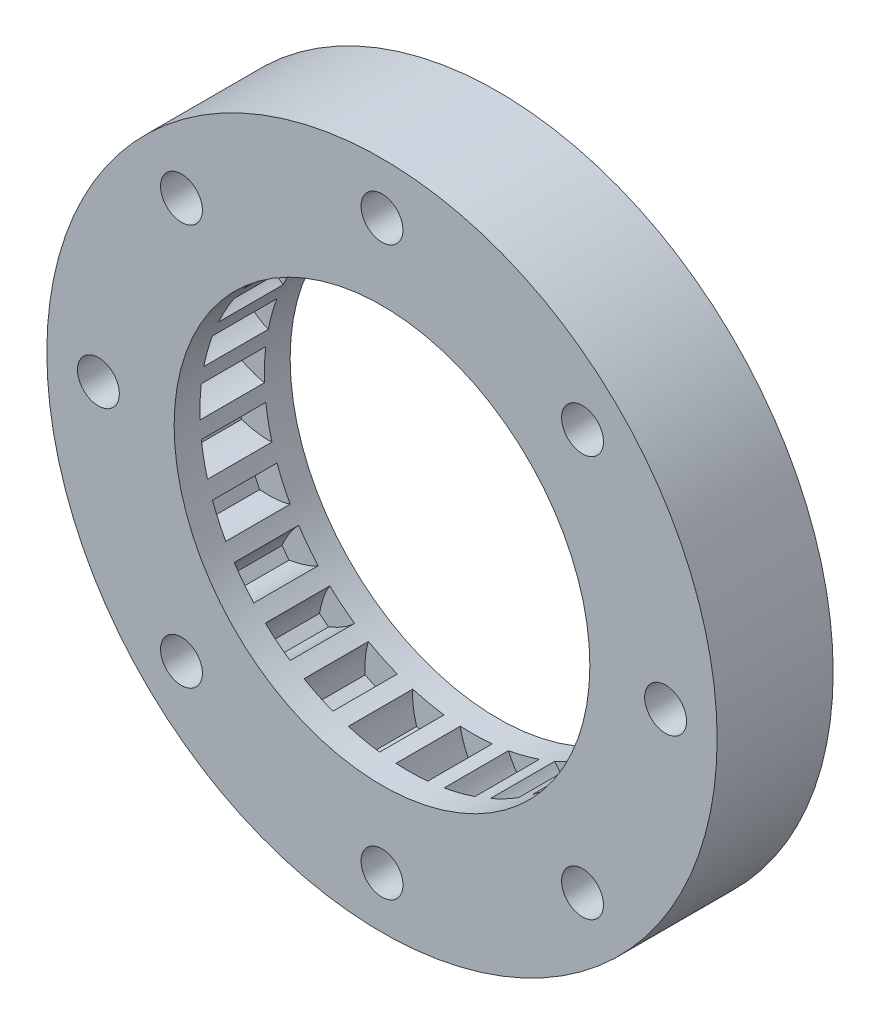
from build123d import *

# Parameters (mm, degrees)
CROQUIS77_R                 = 26
CROQUIS77_R_2               = 16.125
CROQUIS77_R_3               = 1.625
SALIENTE_EXTRUIR1_DEPTH     = 9
CORTAR_EXTRUIR34_DEPTH      = 2.5
CORTAR_EXTRUIR34_DEPTH_BACK = 2.5


with BuildPart() as part:
    # Croquis77 → Saliente-Extruir1 (new body)
    with BuildSketch(Plane(origin=(0, -88.245525224, 0), x_dir=(1, 0, 0), z_dir=(0, 0, 1))):
        with Locations((226.61482719, 201.987096474)):
            Circle(CROQUIS77_R)
        with Locations((226.61482719, 201.987096474)):
            Circle(CROQUIS77_R_2, mode=Mode.SUBTRACT)
        with Locations((248.61482719, 201.987096474)):
            Circle(CROQUIS77_R_3, mode=Mode.SUBTRACT)
        with Locations((242.171176376, 186.430747288)):
            Circle(CROQUIS77_R_3, mode=Mode.SUBTRACT)
        with Locations((226.61482719, 179.987096474)):
            Circle(CROQUIS77_R_3, mode=Mode.SUBTRACT)
        with Locations((211.058478003, 186.430747288)):
            Circle(CROQUIS77_R_3, mode=Mode.SUBTRACT)
        with Locations((204.61482719, 201.987096474)):
            Circle(CROQUIS77_R_3, mode=Mode.SUBTRACT)
        with Locations((211.058478003, 217.54344566)):
            Circle(CROQUIS77_R_3, mode=Mode.SUBTRACT)
        with Locations((226.61482719, 223.987096474)):
            Circle(CROQUIS77_R_3, mode=Mode.SUBTRACT)
        with Locations((242.171176376, 217.54344566)):
            Circle(CROQUIS77_R_3, mode=Mode.SUBTRACT)
    extrude(amount=SALIENTE_EXTRUIR1_DEPTH)

    # Croquis80 → Cortar-Extruir34 (cut, two sides: drawn at the far end of the back side and taken through both)
    with BuildSketch(Plane(origin=(0, -88.245525224, 4.5), x_dir=(1, 0, 0), z_dir=(0, 0, 1)).offset(-CORTAR_EXTRUIR34_DEPTH_BACK)):
        with BuildLine():
            Line((209.076345498, 207.32663772), (208.83645806, 206.463797463))
            add(Edge.make_bspline(
                [(210.901865378, 205.054739598), (210.81477289, 205.090460196), (210.684168137, 205.142933934), (210.508569892, 205.226843539), (210.364583833, 205.301843923), (210.202459466, 205.393823438), (210.021733392, 205.505267626), (209.822054637, 205.639174671), (209.602681203, 205.798511697), (209.263519123, 206.066501995), (209.009024187, 206.295687384), (208.83645806, 206.463797463)],
                knots=[0, 0, 0, 0, 0.112240047, 0.167638162, 0.231904779, 0.305712064, 0.389762058, 0.484920987, 0.592209309, 0.712851342, 1, 1, 1, 1], degree=3))
            Line((210.901865378, 205.054739598), (211.57264766, 207.467445999))
            add(Edge.make_bspline(
                [(211.57264766, 207.467445999), (211.47961584, 207.481803684), (211.340668669, 207.504270956), (211.146959049, 207.523036576), (210.984923748, 207.53311646), (210.798589266, 207.538015712), (210.586275802, 207.535844644), (210.346135245, 207.524216465), (210.076000604, 207.500972808), (209.647185976, 207.446495919), (209.310917813, 207.381554891), (209.076345498, 207.32663772)],
                knots=[0, 0, 0, 0, 0.112240047, 0.167638162, 0.231904779, 0.305712064, 0.389762058, 0.484920987, 0.592209309, 0.712851342, 1, 1, 1, 1], degree=3))
        make_face()
        with BuildLine():
            Line((210.780746184, 211.227251372), (210.348340286, 210.442990936))
            add(Edge.make_bspline(
                [(212.033123177, 208.595598701), (211.956616015, 208.650441356), (211.841633006, 208.731620186), (211.690118921, 208.853763739), (211.567310305, 208.959947948), (211.430767956, 209.086836596), (211.280614176, 209.236955092), (211.117198877, 209.413301745), (210.94048433, 209.618934817), (210.672267223, 209.95791756), (210.477486019, 210.239615798), (210.348340286, 210.442990936)],
                knots=[0, 0, 0, 0, 0.112240047, 0.167638162, 0.231904779, 0.305712064, 0.389762058, 0.484920987, 0.592209309, 0.712851342, 1, 1, 1, 1], degree=3))
            Line((212.033123177, 208.595598701), (213.242232823, 210.788577249))
            add(Edge.make_bspline(
                [(213.242232823, 210.788577249), (213.155019798, 210.824002535), (213.024999275, 210.877907622), (212.840838773, 210.940839925), (212.685495736, 210.988016015), (212.505313769, 211.035754896), (212.298222559, 211.082605205), (212.061873379, 211.126670689), (211.793659897, 211.166350903), (211.363840787, 211.212233904), (211.021660344, 211.226592145), (210.780746184, 211.227251372)],
                knots=[0, 0, 0, 0, 0.112240047, 0.167638162, 0.231904779, 0.305712064, 0.389762058, 0.484920987, 0.592209309, 0.712851342, 1, 1, 1, 1], degree=3))
        make_face()
        with BuildLine():
            Line((213.338747944, 214.62966163), (212.7371347, 213.966260698))
            add(Edge.make_bspline(
                [(213.95046608, 211.780127486), (213.888668765, 211.851135616), (213.795506265, 211.956643167), (213.676244504, 212.110435877), (213.581233973, 212.242079493), (213.477634678, 212.397036674), (213.366148019, 212.577736552), (213.247805938, 212.787015919), (213.123277004, 213.027859304), (212.940464525, 213.419559845), (212.815897758, 213.738584508), (212.7371347, 213.966260698)],
                knots=[0, 0, 0, 0, 0.112240047, 0.167638162, 0.231904779, 0.305712064, 0.389762058, 0.484920987, 0.592209309, 0.712851342, 1, 1, 1, 1], degree=3))
            Line((213.95046608, 211.780127486), (215.632719676, 213.63515414))
            add(Edge.make_bspline(
                [(215.632719676, 213.63515414), (215.556027123, 213.68973724), (215.441942689, 213.772174105), (215.277259445, 213.875880394), (215.136983255, 213.957609417), (214.97266746, 214.045614311), (214.781962844, 214.138960283), (214.562146687, 214.236343848), (214.310313821, 214.336808763), (213.90266189, 214.48057809), (213.573016203, 214.573461543), (213.338747944, 214.62966163)],
                knots=[0, 0, 0, 0, 0.112240047, 0.167638162, 0.231904779, 0.305712064, 0.389762058, 0.484920987, 0.592209309, 0.712851342, 1, 1, 1, 1], degree=3))
        make_face()
        with BuildLine():
            Line((216.612448239, 217.350443675), (215.874060774, 216.843666364))
            add(Edge.make_bspline(
                [(216.550529636, 214.436647183), (216.506773678, 214.519992721), (216.440454101, 214.644141053), (216.359874095, 214.821291916), (216.297783693, 214.971297998), (216.232712515, 215.145969929), (216.165903254, 215.347509611), (216.099014242, 215.578439388), (216.033384308, 215.841509157), (215.945831924, 216.264810819), (215.898195021, 216.603963204), (215.874060774, 216.843666364)],
                knots=[0, 0, 0, 0, 0.112240047, 0.167638162, 0.231904779, 0.305712064, 0.389762058, 0.484920987, 0.592209309, 0.712851342, 1, 1, 1, 1], degree=3))
            Line((216.550529636, 214.436647183), (218.615236456, 215.853716975))
            add(Edge.make_bspline(
                [(218.615236456, 215.853716975), (218.55319889, 215.924515301), (218.461200866, 216.03103975), (218.324872995, 216.169929193), (218.207225978, 216.281805115), (218.067634662, 216.405331656), (217.903597577, 216.540140986), (217.712164788, 216.685592659), (217.490288914, 216.841426184), (217.126780781, 217.075331196), (216.827441135, 217.241732491), (216.612448239, 217.350443675)],
                knots=[0, 0, 0, 0, 0.112240047, 0.167638162, 0.231904779, 0.305712064, 0.389762058, 0.484920987, 0.592209309, 0.712851342, 1, 1, 1, 1], degree=3))
        make_face()
        with BuildLine():
            Line((220.42536104, 219.242919445), (219.590006013, 218.920086249))
            add(Edge.make_bspline(
                [(219.693143746, 216.421944127), (219.669788038, 216.513133893), (219.63388669, 216.649230138), (219.596332529, 216.840188905), (219.570509565, 217.000470585), (219.547474508, 217.185440658), (219.528944349, 217.396955088), (219.517114411, 217.637085791), (219.513921604, 217.908199784), (219.526349287, 218.340282264), (219.558210366, 218.681278579), (219.590006013, 218.920086249)],
                knots=[0, 0, 0, 0, 0.112240047, 0.167638162, 0.231904779, 0.305712064, 0.389762058, 0.484920987, 0.592209309, 0.712851342, 1, 1, 1, 1], degree=3))
            Line((219.693143746, 216.421944127), (222.02899491, 217.324662458))
            add(Edge.make_bspline(
                [(222.02899491, 217.324662458), (221.984956792, 217.407859253), (221.920004815, 217.532728526), (221.81938179, 217.699313557), (221.730706326, 217.835305118), (221.623364893, 217.987693958), (221.49483862, 218.156699041), (221.342109391, 218.342377484), (221.162151893, 218.545178595), (220.862384378, 218.856609411), (220.60948825, 219.087557811), (220.42536104, 219.242919445)],
                knots=[0, 0, 0, 0, 0.112240047, 0.167638162, 0.231904779, 0.305712064, 0.389762058, 0.484920987, 0.592209309, 0.712851342, 1, 1, 1, 1], degree=3))
        make_face()
        with BuildLine():
            Line((224.57193123, 220.205065079), (223.684642848, 220.083580021))
            add(Edge.make_bspline(
                [(223.208889268, 217.628990445), (223.207192925, 217.723108376), (223.203645256, 217.86381555), (223.211141495, 218.058287584), (223.222978091, 218.220204036), (223.243220982, 218.405500467), (223.27396889, 218.615586847), (223.31783578, 218.851972966), (223.377252225, 219.116515359), (223.488989996, 219.534084979), (223.598631417, 219.858542023), (223.684642848, 220.083580021)],
                knots=[0, 0, 0, 0, 0.112240047, 0.167638162, 0.231904779, 0.305712064, 0.389762058, 0.484920987, 0.592209309, 0.712851342, 1, 1, 1, 1], degree=3))
            Line((223.208889268, 217.628990445), (225.689958436, 217.968691537))
            add(Edge.make_bspline(
                [(225.689958436, 217.968691537), (225.666293872, 218.05980164), (225.631889521, 218.196284003), (225.572395954, 218.381583979), (225.517472562, 218.534359839), (225.448167816, 218.707395656), (225.362081239, 218.901485383), (225.256289242, 219.117380624), (225.127951677, 219.35621626), (224.908085322, 219.728383565), (224.715266409, 220.011428581), (224.57193123, 220.205065079)],
                knots=[0, 0, 0, 0, 0.112240047, 0.167638162, 0.231904779, 0.305712064, 0.389762058, 0.484920987, 0.592209309, 0.712851342, 1, 1, 1, 1], degree=3))
        make_face()
        with BuildLine():
            Line((228.828616137, 220.185011059), (227.937228346, 220.271423429))
            add(Edge.make_bspline(
                [(226.908231453, 217.992713958), (226.928285923, 218.084686132), (226.95728319, 218.222418675), (227.009425704, 218.409919938), (227.058283747, 218.564742205), (227.120713286, 218.740375614), (227.199081633, 218.937708133), (227.296280476, 219.157606033), (227.415103018, 219.401315276), (227.620127065, 219.781860749), (227.80163803, 220.07228696), (227.937228346, 220.271423429)],
                knots=[0, 0, 0, 0, 0.112240047, 0.167638162, 0.231904779, 0.305712064, 0.389762058, 0.484920987, 0.592209309, 0.712851342, 1, 1, 1, 1], degree=3))
            Line((226.908231453, 217.992713958), (229.400763543, 217.751084437))
            add(Edge.make_bspline(
                [(229.400763543, 217.751084437), (229.398748297, 217.845196079), (229.396746318, 217.985933732), (229.381589524, 218.179959084), (229.363379136, 218.341283057), (229.335847314, 218.525637446), (229.296841384, 218.73434839), (229.243689893, 218.96882146), (229.173890971, 219.23081593), (229.04577883, 219.643656088), (228.923432048, 219.963538691), (228.828616137, 220.185011059)],
                knots=[0, 0, 0, 0, 0.112240047, 0.167638162, 0.231904779, 0.305712064, 0.389762058, 0.484920987, 0.592209309, 0.712851342, 1, 1, 1, 1], degree=3))
        make_face()
        with BuildLine():
            Line((232.965936776, 219.183838501), (232.118504522, 219.473489786))
            add(Edge.make_bspline(
                [(230.591737805, 217.493506238), (230.632461948, 217.578374411), (230.692440899, 217.705707125), (230.786418672, 217.876129377), (230.869664212, 218.015510949), (230.970914806, 218.172012895), (231.092678735, 218.345953305), (231.237969517, 218.537508233), (231.409792401, 218.747245898), (231.697049823, 219.07025192), (231.940645031, 219.310990345), (232.118504522, 219.473489786)],
                knots=[0, 0, 0, 0, 0.112240047, 0.167638162, 0.231904779, 0.305712064, 0.389762058, 0.484920987, 0.592209309, 0.712851342, 1, 1, 1, 1], degree=3))
            Line((230.591737805, 217.493506238), (232.961359768, 216.683572413))
            add(Edge.make_bspline(
                [(232.961359768, 216.683572413), (232.981102481, 216.775612012), (233.011610802, 216.913017751), (233.041607887, 217.105308522), (233.061092231, 217.266483591), (233.076817581, 217.452217958), (233.086995117, 217.664298459), (233.089349542, 217.904708854), (233.081852142, 218.175737968), (233.052400773, 218.606994659), (233.007121869, 218.946469895), (232.965936776, 219.183838501)],
                knots=[0, 0, 0, 0, 0.112240047, 0.167638162, 0.231904779, 0.305712064, 0.389762058, 0.484920987, 0.592209309, 0.712851342, 1, 1, 1, 1], degree=3))
        make_face()
        with BuildLine():
            Line((236.760849121, 217.255520876), (236.003057697, 217.732795901))
            add(Edge.make_bspline(
                [(234.060829544, 216.158279702), (234.120027909, 216.231468609), (234.207755065, 216.341536955), (234.338501731, 216.485692687), (234.451646979, 216.602119468), (234.586260183, 216.731052889), (234.744855369, 216.872224019), (234.930405426, 217.025109199), (235.145965636, 217.189568274), (235.499970312, 217.437621506), (235.792517481, 217.615693875), (236.003057697, 217.732795901)],
                knots=[0, 0, 0, 0, 0.112240047, 0.167638162, 0.231904779, 0.305712064, 0.389762058, 0.484920987, 0.592209309, 0.712851342, 1, 1, 1, 1], degree=3))
            Line((234.060829544, 216.158279702), (236.179794446, 214.823705316))
            add(Edge.make_bspline(
                [(236.179794446, 214.823705316), (236.220230784, 214.908710993), (236.281604693, 215.035377239), (236.355138506, 215.215566983), (236.411267176, 215.367904159), (236.46940194, 215.545005517), (236.528214268, 215.749022259), (236.585947683, 215.982409393), (236.641155991, 216.247861901), (236.711953124, 216.674285966), (236.746183097, 217.015052636), (236.760849121, 217.255520876)],
                knots=[0, 0, 0, 0, 0.112240047, 0.167638162, 0.231904779, 0.305712064, 0.389762058, 0.484920987, 0.592209309, 0.712851342, 1, 1, 1, 1], degree=3))
        make_face()
        with BuildLine():
            Line((240.008768464, 214.504014289), (239.381470601, 215.143183032))
            add(Edge.make_bspline(
                [(237.128487036, 214.059016758), (237.202968225, 214.116580766), (237.313714192, 214.203450931), (237.474181164, 214.31356867), (237.611126431, 214.400764062), (237.771845211, 214.495178126), (237.958721747, 214.595969402), (238.174528026, 214.701942755), (238.422204656, 214.812257208), (238.823872102, 214.971985037), (239.149599939, 215.077791422), (239.381470601, 215.143183032)],
                knots=[0, 0, 0, 0, 0.112240047, 0.167638162, 0.231904779, 0.305712064, 0.389762058, 0.484920987, 0.592209309, 0.712851342, 1, 1, 1, 1], degree=3))
            Line((237.128487036, 214.059016758), (238.88256093, 212.271749061))
            add(Edge.make_bspline(
                [(238.88256093, 212.271749061), (238.94151096, 212.345138138), (239.030441774, 212.454236282), (239.143548088, 212.612610924), (239.233295173, 212.747897669), (239.330705291, 212.906818438), (239.434981824, 213.091772825), (239.544981804, 213.305554737), (239.659919526, 213.551120027), (239.827148471, 213.949722833), (239.939041972, 214.273410119), (240.008768464, 214.504014289)],
                knots=[0, 0, 0, 0, 0.112240047, 0.167638162, 0.231904779, 0.305712064, 0.389762058, 0.484920987, 0.592209309, 0.712851342, 1, 1, 1, 1], degree=3))
        make_face()
        with BuildLine():
            Line((242.534598634, 211.07765317), (242.071612122, 211.84425788))
            add(Edge.make_bspline(
                [(239.629332071, 211.308889215), (239.715080784, 211.347725033), (239.842875217, 211.406713824), (240.02441168, 211.476857095), (240.177774211, 211.530120372), (240.355934177, 211.58492519), (240.561017499, 211.63990293), (240.795445829, 211.693251404), (241.061886567, 211.743474156), (241.489562788, 211.806265612), (241.83091122, 211.834101964), (242.071612122, 211.84425788)],
                knots=[0, 0, 0, 0, 0.112240047, 0.167638162, 0.231904779, 0.305712064, 0.389762058, 0.484920987, 0.592209309, 0.712851342, 1, 1, 1, 1], degree=3))
            Line((239.629332071, 211.308889215), (240.92395238, 209.165280271))
            add(Edge.make_bspline(
                [(240.92395238, 209.165280271), (240.99823809, 209.223096324), (241.109931526, 209.308744856), (241.256512751, 209.436766378), (241.375039962, 209.547709349), (241.506474029, 209.679882069), (241.650593192, 209.835803164), (241.80692961, 210.018454815), (241.975400424, 210.230894398), (242.230045824, 210.580187165), (242.413570647, 210.869345001), (242.534598634, 211.07765317)],
                knots=[0, 0, 0, 0, 0.112240047, 0.167638162, 0.231904779, 0.305712064, 0.389762058, 0.484920987, 0.592209309, 0.712851342, 1, 1, 1, 1], degree=3))
        make_face()
        with BuildLine():
            Line((244.202171472, 207.161153534), (243.928456034, 208.013866353))
            add(Edge.make_bspline(
                [(241.428543447, 208.05615716), (241.520936948, 208.07417114), (241.658890417, 208.102098456), (241.851709692, 208.128485816), (242.013221673, 208.144945541), (242.199218176, 208.157186573), (242.41145219, 208.163386912), (242.651864479, 208.161234477), (242.922705435, 208.148658005), (243.353334295, 208.111127985), (243.69190114, 208.059493639), (243.928456034, 208.013866353)],
                knots=[0, 0, 0, 0, 0.112240047, 0.167638162, 0.231904779, 0.305712064, 0.389762058, 0.484920987, 0.592209309, 0.712851342, 1, 1, 1, 1], degree=3))
            Line((241.428543447, 208.05615716), (242.193916855, 205.671769483))
            add(Edge.make_bspline(
                [(242.193916855, 205.671769483), (242.279533483, 205.710895632), (242.407968119, 205.768477218), (242.580122022, 205.859243947), (242.721039527, 205.93986218), (242.879411899, 206.038161385), (243.05560419, 206.156643441), (243.249848909, 206.298318034), (243.46277051, 206.466179237), (243.791104366, 206.747331502), (244.03636664, 206.986371314), (244.202171472, 207.161153534)],
                knots=[0, 0, 0, 0, 0.112240047, 0.167638162, 0.231904779, 0.305712064, 0.389762058, 0.484920987, 0.592209309, 0.712851342, 1, 1, 1, 1], degree=3))
        make_face()
        with BuildLine():
            Line((244.921587694, 202.965654891), (244.8518994, 203.85850585))
            add(Edge.make_bspline(
                [(242.429125212, 204.476176221), (242.523182544, 204.472397223), (242.663857942, 204.467757496), (242.857565092, 204.448966396), (243.018519371, 204.427735221), (243.20232529, 204.396752548), (243.410268405, 204.353841225), (243.643703964, 204.29630392), (243.904344034, 204.221606225), (244.314710218, 204.085777983), (244.632243251, 203.957456559), (244.8518994, 203.85850585)],
                knots=[0, 0, 0, 0, 0.112240047, 0.167638162, 0.231904779, 0.305712064, 0.389762058, 0.484920987, 0.592209309, 0.712851342, 1, 1, 1, 1], degree=3))
            Line((242.429125212, 204.476176221), (242.62399024, 201.979552767))
            add(Edge.make_bspline(
                [(242.62399024, 201.979552767), (242.716322172, 201.997879713), (242.854574063, 202.024290114), (243.043019784, 202.072908792), (243.198730683, 202.118856136), (243.375503464, 202.177982492), (243.574270311, 202.252638109), (243.795951549, 202.345697931), (244.041845278, 202.459931312), (244.426167027, 202.657786084), (244.719944599, 202.833821174), (244.921587694, 202.965654891)],
                knots=[0, 0, 0, 0, 0.112240047, 0.167638162, 0.231904779, 0.305712064, 0.389762058, 0.484920987, 0.592209309, 0.712851342, 1, 1, 1, 1], degree=3))
        make_face()
        with BuildLine():
            Line((244.654063386, 198.717337659), (244.79215915, 199.602192931))
            add(Edge.make_bspline(
                [(242.577135744, 200.761944096), (242.667786252, 200.736575848), (242.803599732, 200.699619206), (242.987751955, 200.636662679), (243.139471444, 200.578885182), (243.311177755, 200.50634909), (243.503619704, 200.416639464), (243.717493962, 200.30681914), (243.953881971, 200.174027194), (244.321862533, 199.947223265), (244.601243465, 199.749132605), (244.79215915, 199.602192931)],
                knots=[0, 0, 0, 0, 0.112240047, 0.167638162, 0.231904779, 0.305712064, 0.389762058, 0.484920987, 0.592209309, 0.712851342, 1, 1, 1, 1], degree=3))
            Line((242.577135744, 200.761944096), (242.190987169, 198.287678482))
            add(Edge.make_bspline(
                [(242.190987169, 198.287678482), (242.285056766, 198.284218214), (242.425672718, 198.278033639), (242.620251098, 198.28188322), (242.782360977, 198.290682643), (242.9680043, 198.307448631), (243.178630132, 198.334253108), (243.415796995, 198.373681278), (243.681406658, 198.428128487), (244.100997414, 198.532019363), (244.427452659, 198.635559634), (244.654063386, 198.717337659)],
                knots=[0, 0, 0, 0, 0.112240047, 0.167638162, 0.231904779, 0.305712064, 0.389762058, 0.484920987, 0.592209309, 0.712851342, 1, 1, 1, 1], degree=3))
        make_face()
        with BuildLine():
            Line((243.414020852, 194.645229718), (243.752455897, 195.474386527))
            add(Edge.make_bspline(
                [(241.864595758, 197.113696001), (241.946952449, 197.068106112), (242.07058227, 197.000824896), (242.235251873, 196.897096946), (242.369557336, 196.805887927), (242.519907306, 196.695708854), (242.686473494, 196.564037195), (242.869256434, 196.407854293), (243.068648643, 196.224126946), (243.374405657, 195.918574388), (243.600572989, 195.66139361), (243.752455897, 195.474386527)],
                knots=[0, 0, 0, 0, 0.112240047, 0.167638162, 0.231904779, 0.305712064, 0.389762058, 0.484920987, 0.592209309, 0.712851342, 1, 1, 1, 1], degree=3))
            Line((241.864595758, 197.113696001), (240.918250949, 194.795176527))
            add(Edge.make_bspline(
                [(240.918250949, 194.795176527), (241.008986895, 194.770115589), (241.144386264, 194.73166945), (241.334607534, 194.690542402), (241.494377006, 194.661719525), (241.678882793, 194.635221287), (241.890012715, 194.612729585), (242.129879477, 194.596400522), (242.400885987, 194.588126296), (242.833125505, 194.592452492), (243.174659137, 194.617916061), (243.414020852, 194.645229718)],
                knots=[0, 0, 0, 0, 0.112240047, 0.167638162, 0.231904779, 0.305712064, 0.389762058, 0.484920987, 0.592209309, 0.712851342, 1, 1, 1, 1], degree=3))
        make_face()
        with BuildLine():
            Line((241.268311107, 190.968859463), (241.788840311, 191.69761775))
            add(Edge.make_bspline(
                [(240.329918468, 193.728109935), (240.399541472, 193.664756167), (240.504322719, 193.570777527), (240.64063232, 193.431870153), (240.750283314, 193.312146713), (240.871171539, 193.170264442), (241.00288234, 193.003729203), (241.144720086, 192.809603585), (241.29636721, 192.584845624), (241.523417234, 192.217016855), (241.684178228, 191.914610642), (241.788840311, 191.69761775)],
                knots=[0, 0, 0, 0, 0.112240047, 0.167638162, 0.231904779, 0.305712064, 0.389762058, 0.484920987, 0.592209309, 0.712851342, 1, 1, 1, 1], degree=3))
            Line((240.329918468, 193.728109935), (238.874395119, 191.690328585))
            add(Edge.make_bspline(
                [(238.874395119, 191.690328585), (238.956905815, 191.645018019), (239.079789187, 191.576382957), (239.255398468, 191.49249645), (239.404214321, 191.427605122), (239.577635816, 191.359271185), (239.777887761, 191.288695839), (240.007523141, 191.217489845), (240.269316468, 191.14694025), (240.690902604, 191.05146854), (241.029102455, 190.99748266), (241.268311107, 190.968859463)],
                knots=[0, 0, 0, 0, 0.112240047, 0.167638162, 0.231904779, 0.305712064, 0.389762058, 0.484920987, 0.592209309, 0.712851342, 1, 1, 1, 1], degree=3))
        make_face()
        with BuildLine():
            Line((238.332609919, 187.886420965), (239.007171417, 188.475493182))
            add(Edge.make_bspline(
                [(238.055838724, 190.787703719), (238.108974647, 190.71000149), (238.189258537, 190.594391838), (238.289859649, 190.427793573), (238.368944861, 190.286010035), (238.453854225, 190.120073475), (238.543609075, 189.927652614), (238.636855117, 189.706049642), (238.732581821, 189.452377827), (238.868684531, 189.042102591), (238.955372519, 188.71077374), (239.007171417, 188.475493182)],
                knots=[0, 0, 0, 0, 0.112240047, 0.167638162, 0.231904779, 0.305712064, 0.389762058, 0.484920987, 0.592209309, 0.712851342, 1, 1, 1, 1], degree=3))
            Line((238.055838724, 190.787703719), (236.169604475, 189.140517814))
            add(Edge.make_bspline(
                [(236.169604475, 189.140517814), (236.23944175, 189.077400323), (236.34318445, 188.982276473), (236.4947146, 188.860152851), (236.624554132, 188.762691379), (236.777542138, 188.656205643), (236.956120471, 188.541351388), (237.163144767, 188.419107198), (237.401611565, 188.29008558), (237.7898165, 188.099962868), (238.10645013, 187.969437931), (238.332609919, 187.886420965)],
                knots=[0, 0, 0, 0, 0.112240047, 0.167638162, 0.231904779, 0.305712064, 0.389762058, 0.484920987, 0.592209309, 0.712851342, 1, 1, 1, 1], degree=3))
        make_face()
        with BuildLine():
            Line((234.765181698, 185.564089281), (235.557409706, 185.981718394))
            add(Edge.make_bspline(
                [(235.164952755, 188.450995413), (235.198737025, 188.363133671), (235.250195431, 188.232125552), (235.309664624, 188.046817753), (235.35392055, 187.890617703), (235.398273566, 187.709572538), (235.441233758, 187.501639513), (235.480861179, 187.264505861), (235.515506811, 186.995595705), (235.553324873, 186.564992046), (235.561266484, 186.222602582), (235.557409706, 185.981718394)],
                knots=[0, 0, 0, 0, 0.112240047, 0.167638162, 0.231904779, 0.305712064, 0.389762058, 0.484920987, 0.592209309, 0.712851342, 1, 1, 1, 1], degree=3))
            Line((235.164952755, 188.450995413), (232.949694982, 187.283205171))
            add(Edge.make_bspline(
                [(232.949694982, 187.283205171), (233.003093889, 187.205683437), (233.082103122, 187.089198949), (233.201385111, 186.935421927), (233.30524864, 186.810644485), (233.429555533, 186.671747624), (233.57683305, 186.518806283), (233.75008553, 186.352114112), (233.952369992, 186.17157606), (234.286265498, 185.897051912), (234.564263105, 185.697024551), (234.765181698, 185.564089281)],
                knots=[0, 0, 0, 0, 0.112240047, 0.167638162, 0.231904779, 0.305712064, 0.389762058, 0.484920987, 0.592209309, 0.712851342, 1, 1, 1, 1], degree=3))
        make_face()
        with BuildLine():
            Line((230.758347422, 184.127061914), (231.625532723, 184.350733428))
            add(Edge.make_bspline(
                [(231.81310897, 186.843957567), (231.825720269, 186.750672961), (231.845579056, 186.611329058), (231.860710329, 186.417301714), (231.86775112, 186.255105938), (231.869156707, 186.068712359), (231.863006246, 185.856476894), (231.846878721, 185.616596498), (231.818575525, 185.346945018), (231.756070159, 184.919226891), (231.684837259, 184.584235117), (231.625532723, 184.350733428)],
                knots=[0, 0, 0, 0, 0.112240047, 0.167638162, 0.231904779, 0.305712064, 0.389762058, 0.484920987, 0.592209309, 0.712851342, 1, 1, 1, 1], degree=3))
            Line((231.81310897, 186.843957567), (229.388252794, 186.218518863))
            add(Edge.make_bspline(
                [(229.388252794, 186.218518863), (229.422334584, 186.130772101), (229.472350941, 185.999206685), (229.552954248, 185.822066423), (229.625242463, 185.676699795), (229.714166827, 185.512879774), (229.822203759, 185.330096453), (229.952344336, 185.12794272), (230.107541253, 184.905621088), (230.369126937, 184.561495171), (230.593501599, 184.302748913), (230.758347422, 184.127061914)],
                knots=[0, 0, 0, 0, 0.112240047, 0.167638162, 0.231904779, 0.305712064, 0.389762058, 0.484920987, 0.592209309, 0.712851342, 1, 1, 1, 1], degree=3))
        make_face()
        with BuildLine():
            Line((226.528116566, 183.652809381), (227.423508976, 183.670465107))
            add(Edge.make_bspline(
                [(228.181006137, 186.053226007), (228.171764585, 185.959547534), (228.15895316, 185.819379913), (228.128930783, 185.62709309), (228.098376869, 185.467645603), (228.056759251, 185.285952137), (228.001829709, 185.0808559), (227.930816677, 184.851160774), (227.841090487, 184.595304951), (227.681631373, 184.193530751), (227.535064145, 183.883996161), (227.423508976, 183.670465107)],
                knots=[0, 0, 0, 0, 0.112240047, 0.167638162, 0.231904779, 0.305712064, 0.389762058, 0.484920987, 0.592209309, 0.712851342, 1, 1, 1, 1], degree=3))
            Line((228.181006137, 186.053226007), (225.677276181, 186.003856403))
            add(Edge.make_bspline(
                [(225.677276181, 186.003856403), (225.690203496, 185.910615065), (225.708530583, 185.771061446), (225.746109861, 185.58010762), (225.782925686, 185.421988559), (225.831673586, 185.242076958), (225.894645634, 185.039305555), (225.974658395, 184.812588419), (226.074401063, 184.560468623), (226.249574773, 184.165292854), (226.408230394, 183.861776777), (226.528116566, 183.652809381)],
                knots=[0, 0, 0, 0, 0.112240047, 0.167638162, 0.231904779, 0.305712064, 0.389762058, 0.484920987, 0.592209309, 0.712851342, 1, 1, 1, 1], degree=3))
        make_face()
        with BuildLine():
            Line((222.302541969, 184.166898759), (223.177870651, 183.977586872))
            add(Edge.make_bspline(
                [(224.464451858, 186.121429277), (224.433855671, 186.032407168), (224.389064702, 185.8989723), (224.315507188, 185.71879223), (224.249005738, 185.570688889), (224.166608531, 185.403490677), (224.065861175, 185.21659046), (223.943790967, 185.009463527), (223.797478945, 184.781196614), (223.549662565, 184.427026092), (223.335662486, 184.159635776), (223.177870651, 183.977586872)],
                knots=[0, 0, 0, 0, 0.112240047, 0.167638162, 0.231904779, 0.305712064, 0.389762058, 0.484920987, 0.592209309, 0.712851342, 1, 1, 1, 1], degree=3))
            Line((224.464451858, 186.121429277), (222.016824853, 186.6507903))
            add(Edge.make_bspline(
                [(222.016824853, 186.6507903), (222.007900778, 186.557081051), (221.993550576, 186.4170626), (221.986079917, 186.222589582), (221.985438602, 186.060242327), (221.991382026, 185.873938227), (222.00589435, 185.662110199), (222.031465788, 185.423052041), (222.070377053, 185.154725924), (222.149695129, 184.729804332), (222.234078542, 184.397881066), (222.302541969, 184.166898759)],
                knots=[0, 0, 0, 0, 0.112240047, 0.167638162, 0.231904779, 0.305712064, 0.389762058, 0.484920987, 0.592209309, 0.712851342, 1, 1, 1, 1], degree=3))
        make_face()
        with BuildLine():
            Line((218.309425451, 185.641615356), (219.11750121, 185.25554171))
            add(Edge.make_bspline(
                [(220.863806536, 187.044890519), (220.813505163, 186.965323979), (220.739149342, 186.845815374), (220.626022197, 186.687455611), (220.527158321, 186.558680704), (220.40842358, 186.414991445), (220.267289726, 186.256363087), (220.100743178, 186.082970615), (219.905733043, 185.894598541), (219.582919242, 185.607125121), (219.313023112, 185.396294161), (219.11750121, 185.25554171)],
                knots=[0, 0, 0, 0, 0.112240047, 0.167638162, 0.231904779, 0.305712064, 0.389762058, 0.484920987, 0.592209309, 0.712851342, 1, 1, 1, 1], degree=3))
            Line((220.863806536, 187.044890519), (218.604234688, 188.124444181))
            add(Edge.make_bspline(
                [(218.604234688, 188.124444181), (218.573940323, 188.035318909), (218.527686455, 187.902384059), (218.475568605, 187.714875939), (218.437504723, 187.557052672), (218.400323258, 187.374399776), (218.365593496, 187.164934828), (218.335345047, 186.926423333), (218.311327192, 186.656356426), (218.290513576, 186.224596643), (218.296075651, 185.882160258), (218.309425451, 185.641615356)],
                knots=[0, 0, 0, 0, 0.112240047, 0.167638162, 0.231904779, 0.305712064, 0.389762058, 0.484920987, 0.592209309, 0.712851342, 1, 1, 1, 1], degree=3))
        make_face()
        with BuildLine():
            Line((214.764036959, 187.997456819), (215.46129622, 187.435434743))
            add(Edge.make_bspline(
                [(217.573181895, 188.773825701), (217.505887094, 188.708004182), (217.405974963, 188.608864579), (217.2593769, 188.480862339), (217.133480375, 188.378358155), (216.984809121, 188.265924175), (216.810897331, 188.144119371), (216.608853012, 188.013808993), (216.375657809, 187.875486944), (215.995249564, 187.670208394), (215.684007554, 187.52730274), (215.46129622, 187.435434743)],
                knots=[0, 0, 0, 0, 0.112240047, 0.167638162, 0.231904779, 0.305712064, 0.389762058, 0.484920987, 0.592209309, 0.712851342, 1, 1, 1, 1], degree=3))
            Line((217.573181895, 188.773825701), (215.623479305, 190.345372983))
            add(Edge.make_bspline(
                [(215.623479305, 190.345372983), (215.573447826, 190.265636456), (215.497783852, 190.146951757), (215.403828496, 189.976517146), (215.330394081, 189.831726162), (215.252092191, 189.662571333), (215.169992633, 189.466761775), (215.085554998, 189.241655161), (214.999902833, 188.984406841), (214.880079593, 188.569085149), (214.806520476, 188.234596478), (214.764036959, 187.997456819)],
                knots=[0, 0, 0, 0, 0.112240047, 0.167638162, 0.231904779, 0.305712064, 0.389762058, 0.484920987, 0.592209309, 0.712851342, 1, 1, 1, 1], degree=3))
        make_face()
        with BuildLine():
            Line((211.857509302, 191.107419125), (212.406362639, 190.399747375))
            add(Edge.make_bspline(
                [(214.769976358, 191.215027477), (214.689316011, 191.166499435), (214.569233858, 191.093073477), (214.397068017, 191.002329393), (214.250925958, 190.93162196), (214.080333096, 190.856504602), (213.883019, 190.778089882), (213.65636917, 190.697886663), (213.397560515, 190.617071618), (212.980065731, 190.505054557), (212.644256978, 190.43777829), (212.406362639, 190.399747375)],
                knots=[0, 0, 0, 0, 0.112240047, 0.167638162, 0.231904779, 0.305712064, 0.389762058, 0.484920987, 0.592209309, 0.712851342, 1, 1, 1, 1], degree=3))
            Line((214.769976358, 191.215027477), (213.235251999, 193.193845859))
            add(Edge.make_bspline(
                [(213.235251999, 193.193845859), (213.168180617, 193.127796694), (213.067185599, 193.02976047), (212.936457896, 192.885587543), (212.831611816, 192.761634559), (212.716410776, 192.61509698), (212.59136743, 192.443498954), (212.457292665, 192.243932777), (212.31462372, 192.013371367), (212.102250557, 191.636877866), (211.953535839, 191.32836928), (211.857509302, 191.107419125)],
                knots=[0, 0, 0, 0, 0.112240047, 0.167638162, 0.231904779, 0.305712064, 0.389762058, 0.484920987, 0.592209309, 0.712851342, 1, 1, 1, 1], degree=3))
        make_face()
        with BuildLine():
            Line((209.74653414, 194.803843401), (210.117392727, 193.988672744))
            add(Edge.make_bspline(
                [(212.605311463, 194.23689003), (212.515633989, 194.208271624), (212.381855475, 194.164517722), (212.193403361, 194.115923832), (212.034894323, 194.080825005), (211.85157656, 194.047073867), (211.641497412, 194.016276587), (211.402460822, 193.990504305), (211.131991156, 193.971553023), (210.699917085, 193.958836319), (210.357645126, 193.970816321), (210.117392727, 193.988672744)],
                knots=[0, 0, 0, 0, 0.112240047, 0.167638162, 0.231904779, 0.305712064, 0.389762058, 0.484920987, 0.592209309, 0.712851342, 1, 1, 1, 1], degree=3))
            Line((212.605311463, 194.23689003), (211.568302722, 196.516300901))
            add(Edge.make_bspline(
                [(211.568302722, 196.516300901), (211.487807272, 196.467499825), (211.366925879, 196.395397234), (211.206473393, 196.285258389), (211.075867927, 196.188825744), (210.929978254, 196.072805293), (210.76873224, 195.934669694), (210.59224835, 195.771402618), (210.400253944, 195.579957744), (210.106779951, 195.262589296), (209.890926881, 194.996692573), (209.74653414, 194.803843401)],
                knots=[0, 0, 0, 0, 0.112240047, 0.167638162, 0.231904779, 0.305712064, 0.389762058, 0.484920987, 0.592209309, 0.712851342, 1, 1, 1, 1], degree=3))
        make_face()
        with BuildLine():
            Line((208.544914689, 198.887454458), (208.717785445, 198.008730955))
            add(Edge.make_bspline(
                [(211.195884854, 197.676503966), (211.10202479, 197.669338021), (210.961761949, 197.65761496), (210.767183063, 197.653790973), (210.604852311, 197.656192939), (210.418692353, 197.665627553), (210.207173574, 197.684108004), (209.96863675, 197.714156048), (209.701087162, 197.758090198), (209.27772703, 197.845359412), (208.947443834, 197.935949838), (208.717785445, 198.008730955)],
                knots=[0, 0, 0, 0, 0.112240047, 0.167638162, 0.231904779, 0.305712064, 0.389762058, 0.484920987, 0.592209309, 0.712851342, 1, 1, 1, 1], degree=3))
            Line((211.195884854, 197.676503966), (210.712497141, 200.133623696))
            add(Edge.make_bspline(
                [(210.712497141, 200.133623696), (210.622917153, 200.104701587), (210.488666132, 200.062419699), (210.307138898, 199.992252551), (210.157815021, 199.928538953), (209.989101666, 199.849290322), (209.800345797, 199.752064076), (209.590967074, 199.633897871), (209.359997677, 199.491890375), (209.001244111, 199.250756395), (208.729889385, 199.041806097), (208.544914689, 198.887454458)],
                knots=[0, 0, 0, 0, 0.112240047, 0.167638162, 0.231904779, 0.305712064, 0.389762058, 0.484920987, 0.592209309, 0.712851342, 1, 1, 1, 1], degree=3))
        make_face()
        with BuildLine():
            Line((208.317430566, 203.138103765), (208.282993982, 202.243199629))
            add(Edge.make_bspline(
                [(210.617679085, 201.348438808), (210.52469645, 201.363111643), (210.385510888, 201.384051415), (210.19529503, 201.425203484), (210.037893855, 201.464976752), (209.858927635, 201.517088496), (209.657372257, 201.583850391), (209.432194779, 201.668098863), (209.181988938, 201.772549944), (208.790166199, 201.955100371), (208.489677419, 202.119417466), (208.282993982, 202.243199629)],
                knots=[0, 0, 0, 0, 0.112240047, 0.167638162, 0.231904779, 0.305712064, 0.389762058, 0.484920987, 0.592209309, 0.712851342, 1, 1, 1, 1], degree=3))
            Line((210.617679085, 201.348438808), (210.713971956, 203.850803436))
            add(Edge.make_bspline(
                [(210.713971956, 203.850803436), (210.620136711, 203.843319493), (210.479753569, 203.833137735), (210.286937767, 203.806725012), (210.126945568, 203.779165279), (209.944503911, 203.740960782), (209.738414066, 203.689885382), (209.507428171, 203.623190418), (209.249935401, 203.538275962), (208.845242762, 203.386376045), (208.533015183, 203.245636736), (208.317430566, 203.138103765)],
                knots=[0, 0, 0, 0, 0.112240047, 0.167638162, 0.231904779, 0.305712064, 0.389762058, 0.484920987, 0.592209309, 0.712851342, 1, 1, 1, 1], degree=3))
        make_face()
    extrude(amount=CORTAR_EXTRUIR34_DEPTH + CORTAR_EXTRUIR34_DEPTH_BACK, mode=Mode.SUBTRACT)


solid = part.part
